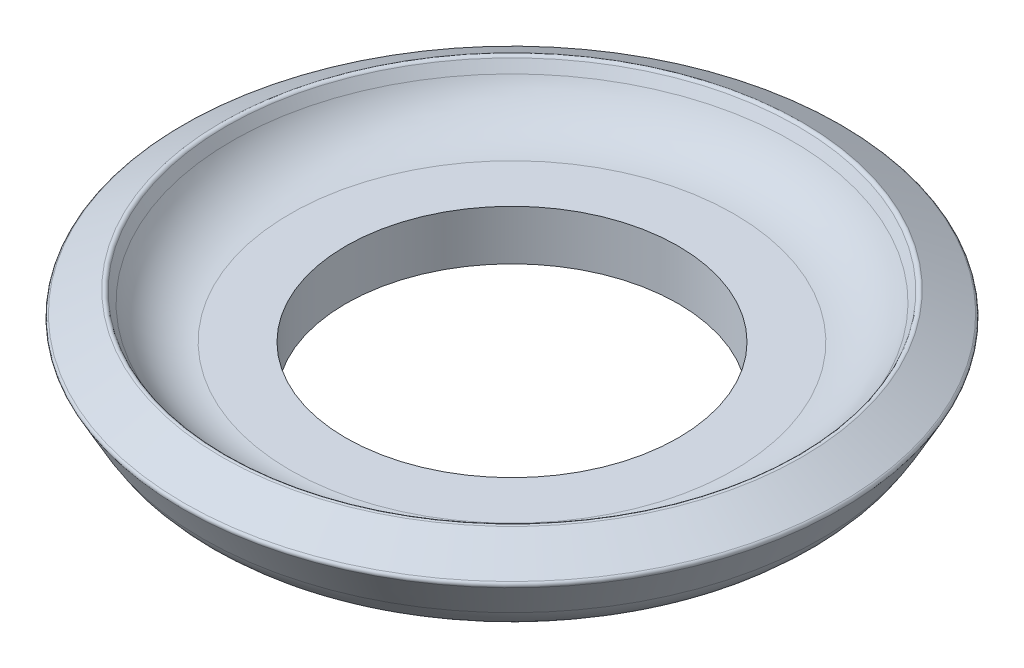
from build123d import *


with BuildPart() as part:
    # Sketch1 → Revolve1 (revolve)
    with BuildSketch(Plane.XY, mode=Mode.PRIVATE) as revolve1_sk:
        with BuildLine():
            Line((5, 1.176406116), (7.558093955, 1.176406116))
            ThreePointArc((7.558093955, 1.176406116), (8.571401526, 1.452106905), (9.305339399, 2.203198348))
            Line((9.305339399, 2.203198348), (9.901270116, 3.273100648))
            ThreePointArc((9.901270116, 3.273100648), (9.910090389, 3.349127401), (9.862568232, 3.409123309))
            Line((9.862568232, 3.409123309), (8.726858693, 4.041708358))
            ThreePointArc((8.726858693, 4.041708358), (8.65083194, 4.050528631), (8.590836033, 4.003006474))
            Line((8.590836033, 4.003006474), (8.42384427, 3.703198348))
            ThreePointArc((8.42384427, 3.703198348), (7.689906396, 2.952106905), (6.676598826, 2.676406116))
            Line((6.676598826, 2.676406116), (5, 2.676406116))
            Line((5, 2.676406116), (5, 1.176406116))
        make_face()
    revolve(revolve1_sk.sketch.rotate(Axis((0, 4.371150449, 0), (0, -1, 0)), 90), axis=Axis((0, 4.371150449, 0), (0, -1, 0)))


solid = part.part
